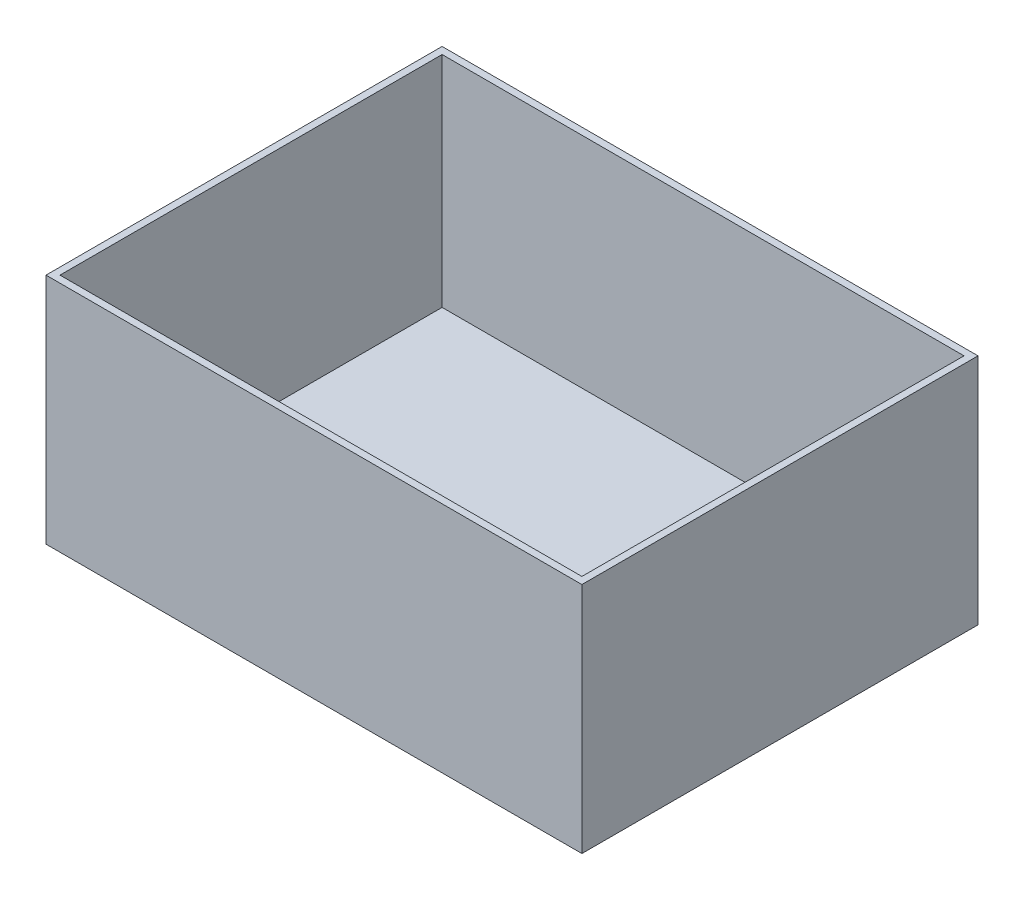
from build123d import *

# Parameters (mm, degrees)
SKICA5_W                 = 230
SKICA5_H                 = 100
P_IDAT_VYSUNUT_M3_DEPTH  = 170
SKICA8_W                 = 224
SKICA8_H                 = 164
ODEBRAT_VYSUNUT_M3_DEPTH = 94


with BuildPart() as part:
    # Skica5 → Přidat vysunutím3 (new body)
    with BuildSketch(Plane.XY):
        Rectangle(SKICA5_W, SKICA5_H)
    extrude(amount=P_IDAT_VYSUNUT_M3_DEPTH)

    # Skica8 → Odebrat vysunutím3 (cut)
    with BuildSketch(Plane(origin=(0, 50, 0), x_dir=(1, 0, 0), z_dir=(0, 1, 0))):
        with Locations((0, -85)):
            Rectangle(SKICA8_W, SKICA8_H)
    extrude(amount=-ODEBRAT_VYSUNUT_M3_DEPTH, mode=Mode.SUBTRACT)


solid = part.part
